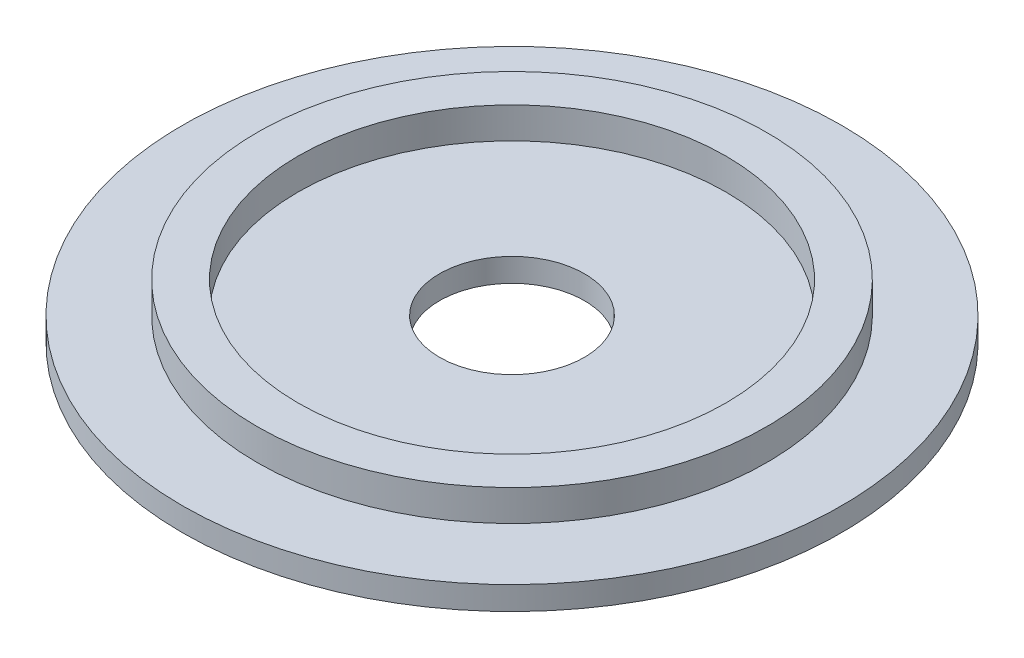
from build123d import *

# Parameters (mm, degrees)
SKETCH1_R           = 21.15
SKETCH1_R_2         = 4.65
BOSS_EXTRUDE1_DEPTH = 1.5
SKETCH1_3_R         = 16.35319065
SKETCH1_3_R_2       = 13.728990349
BOSS_EXTRUDE2_DEPTH = 3.5


with BuildPart() as part:
    # Sketch1 → Boss-Extrude1 (new body)
    with BuildSketch(Plane(origin=(0, 0, 0), x_dir=(1, 0, 0), z_dir=(0, 1, 0))):
        Circle(SKETCH1_R)
        Circle(SKETCH1_R_2, mode=Mode.SUBTRACT)
    extrude(amount=BOSS_EXTRUDE1_DEPTH)

    # Sketch1<3> → Boss-Extrude2 (add)
    with BuildSketch(Plane(origin=(0, 0, 0), x_dir=(1, 0, 0), z_dir=(0, 1, 0))):
        Circle(SKETCH1_3_R)
        Circle(SKETCH1_3_R_2, mode=Mode.SUBTRACT)
    extrude(amount=BOSS_EXTRUDE2_DEPTH)


solid = part.part
